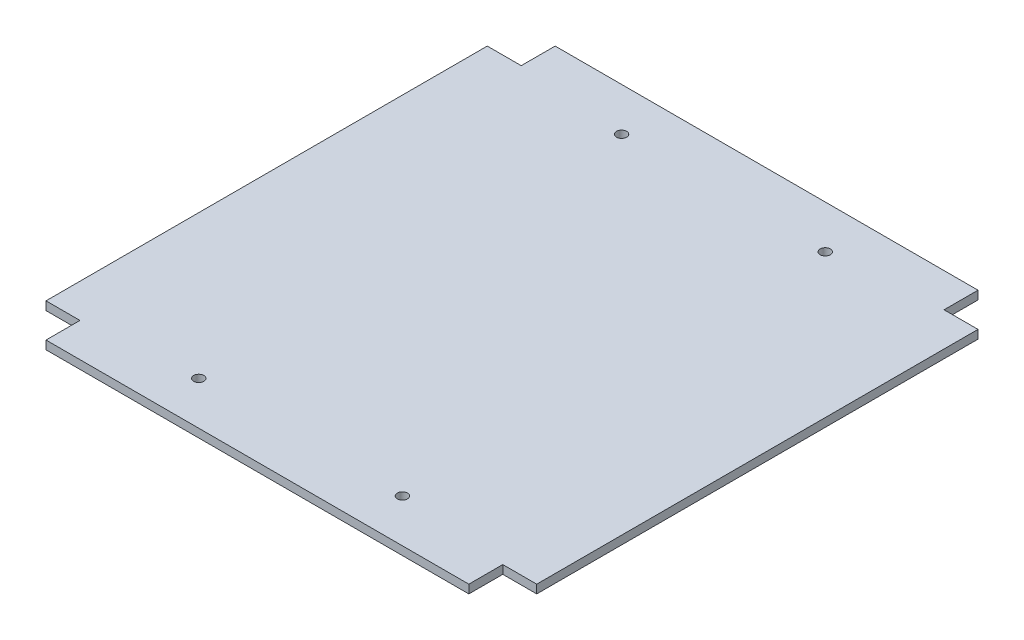
from build123d import *

# Parameters (mm, degrees)
ESQUISSE1_R        = 3
ESQUISSE1_W        = 40
ESQUISSE1_H        = 80
BOSS_EXTRU_1_DEPTH = 5


with BuildPart() as part:
    # Esquisse1 → Boss.-Extru.1 (new body)
    # profile 1 of 7: a face of its own
    with BuildSketch(Plane(origin=(0, 0, 0), x_dir=(1, 0, 0), z_dir=(0, 1, 0))):
        with BuildLine():
            Line((-144.568322948, 130), (-144.568322948, 40))
            ThreePointArc((-144.568322948, 40), (-90.829510466, 119.373363982), (3.94e-07, 150))
            Line((3.94e-07, 150), (-124.568322948, 150))
            Line((-124.568322948, 150), (-124.568322948, 130))
            Line((-124.568322948, 130), (-144.568322948, 130))
        make_face()
    # profile 2 of 7: a face of its own
    with BuildSketch(Plane(origin=(0, 0, 0), x_dir=(1, 0, 0), z_dir=(0, 1, 0))):
        with BuildLine():
            ThreePointArc((3.94e-07, 150), (-90.829510466, 119.373363982), (-144.568322948, 40))
            Line((-144.568322948, 40), (-104.568322948, 40))
            Line((-104.568322948, 40), (-104.568322948, -40))
            Line((-104.568322948, -40), (-144.568322948, -40))
            ThreePointArc((-144.568322948, -40), (-90.829510457, -119.373363989), (4.17e-07, -150))
            ThreePointArc((4.17e-07, -150), (90.829510789, -119.373363737), (144.568322948, -40))
            Line((144.568322948, -40), (104.568322948, -40))
            Line((104.568322948, -40), (104.568322948, 40))
            Line((104.568322948, 40), (144.568322948, 40))
            ThreePointArc((144.568322948, 40), (90.82951078, 119.373363744), (3.94e-07, 150))
        make_face()
        with Locations(Location((-60, -124.57, 0), (0, 0, 270))):
            Circle(ESQUISSE1_R, mode=Mode.SUBTRACT)
        with Locations(Location((60, -124.57, 0), (0, 0, 270))):
            Circle(ESQUISSE1_R, mode=Mode.SUBTRACT)
        with Locations(Location((-60, 124.57, 0), (0, 0, 270))):
            Circle(ESQUISSE1_R, mode=Mode.SUBTRACT)
        with Locations(Location((60, 124.57, 0), (0, 0, 270))):
            Circle(ESQUISSE1_R, mode=Mode.SUBTRACT)
    # profile 3 of 7: a face of its own
    with BuildSketch(Plane(origin=(0, 0, 0), x_dir=(1, 0, 0), z_dir=(0, 1, 0))):
        with BuildLine():
            ThreePointArc((4.17e-07, -150), (-90.829510457, -119.373363989), (-144.568322948, -40))
            Line((-144.568322948, -40), (-144.568322948, -130))
            Line((-144.568322948, -130), (-124.568322948, -130))
            Line((-124.568322948, -130), (-124.568322948, -150))
            Line((-124.568322948, -150), (4.17e-07, -150))
        make_face()
    # profile 4 of 7: a face of its own
    with BuildSketch(Plane(origin=(0, 0, 0), x_dir=(1, 0, 0), z_dir=(0, 1, 0))):
        with BuildLine():
            ThreePointArc((144.568322948, -40), (90.829510789, -119.373363737), (4.17e-07, -150))
            Line((4.17e-07, -150), (124.568322948, -150))
            Line((124.568322948, -150), (124.568322948, -130))
            Line((124.568322948, -130), (144.568322948, -130))
            Line((144.568322948, -130), (144.568322948, -40))
        make_face()
    # profile 5 of 7: a face of its own
    with BuildSketch(Plane(origin=(0, 0, 0), x_dir=(1, 0, 0), z_dir=(0, 1, 0))):
        with BuildLine():
            Line((124.568322948, 150), (3.94e-07, 150))
            ThreePointArc((3.94e-07, 150), (90.82951078, 119.373363744), (144.568322948, 40))
            Line((144.568322948, 40), (144.568322948, 130))
            Line((144.568322948, 130), (124.568322948, 130))
            Line((124.568322948, 130), (124.568322948, 150))
        make_face()
    # profile 6 of 7: a face of its own
    with BuildSketch(Plane(origin=(0, 0, 0), x_dir=(1, 0, 0), z_dir=(0, 1, 0))):
        with Locations((-124.568322948, 0)):
            Rectangle(ESQUISSE1_W, ESQUISSE1_H)
    # profile 7 of 7: a face of its own
    with BuildSketch(Plane(origin=(0, 0, 0), x_dir=(1, 0, 0), z_dir=(0, 1, 0))):
        with Locations((124.568322948, 0)):
            Rectangle(ESQUISSE1_W, ESQUISSE1_H)
    extrude(amount=BOSS_EXTRU_1_DEPTH)


solid = part.part
